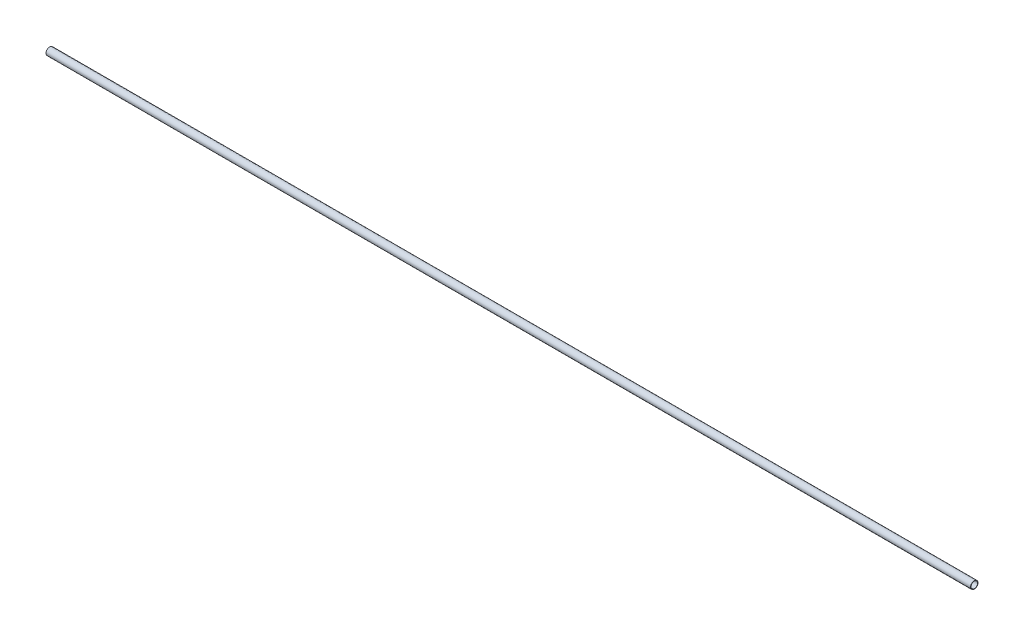
from build123d import *

# Parameters (mm, degrees)
SKETCH1_R           = 8.9662
SKETCH1_R_2         = 7.8994
BOSS_EXTRUDE1_DEPTH = 2235.2


with BuildPart() as part:
    # Sketch1 → Boss-Extrude1 (new body)
    with BuildSketch(Plane(origin=(0, 0, 0), x_dir=(0, 0, -1), z_dir=(1, 0, 0))):
        Circle(SKETCH1_R)
        Circle(SKETCH1_R_2, mode=Mode.SUBTRACT)
    extrude(amount=BOSS_EXTRUDE1_DEPTH)


solid = part.part
